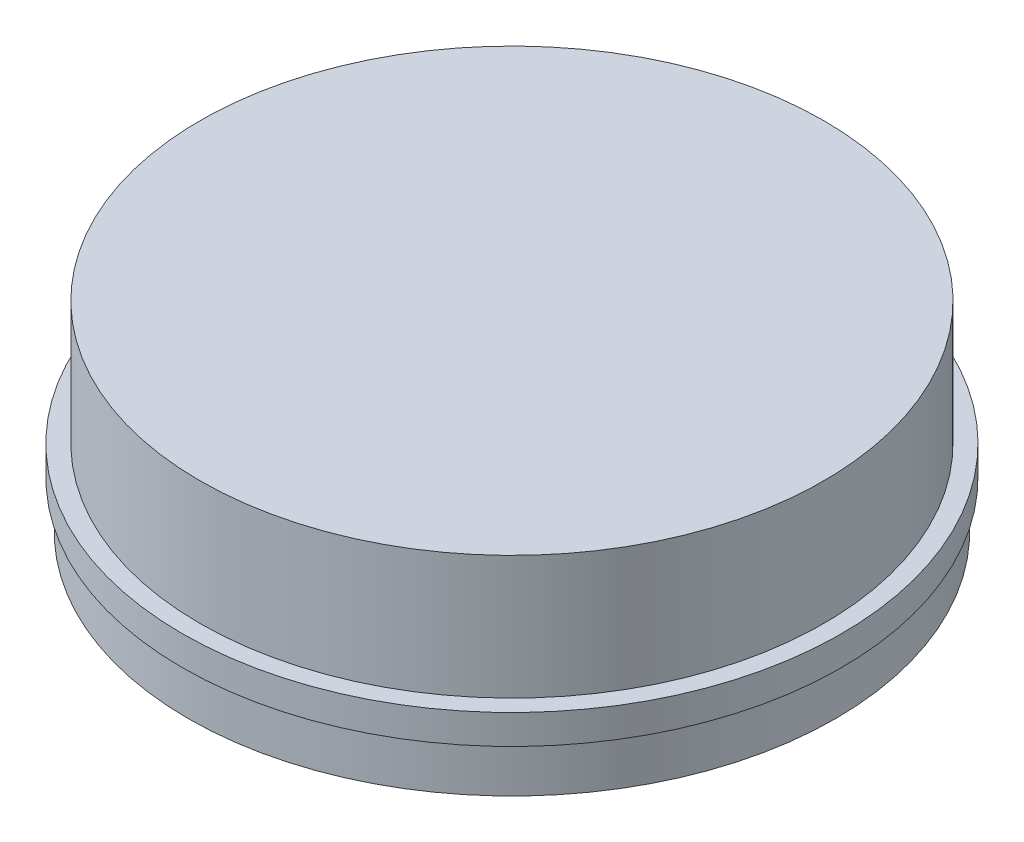
from build123d import *

# Parameters (mm, degrees)
SKETCH1_R           = 26.5
BOSS_EXTRUDE1_DEPTH = 10.5
SKETCH1_3_R         = 28
BOSS_EXTRUDE2_DEPTH = 2.5
BOSS_EXTRUDE3_START = -6.5
SKETCH1_4_R         = 27.5
SKETCH1_4_R_2       = 26.5
BOSS_EXTRUDE3_DEPTH = 6.5


with BuildPart() as part:
    # Sketch1 → Boss-Extrude1 (new body)
    with BuildSketch(Plane(origin=(0, 0, 0), x_dir=(1, 0, 0), z_dir=(0, 1, 0))):
        Circle(SKETCH1_R)
    extrude(amount=BOSS_EXTRUDE1_DEPTH)

    # Sketch1<3> → Boss-Extrude2 (add)
    with BuildSketch(Plane(origin=(0, 0, 0), x_dir=(1, 0, 0), z_dir=(0, 1, 0))):
        Circle(SKETCH1_3_R)
    extrude(amount=-BOSS_EXTRUDE2_DEPTH)

    # Sketch1<4> → Boss-Extrude3 (add)
    with BuildSketch(Plane(origin=(0, 0, 0), x_dir=(1, 0, 0), z_dir=(0, 1, 0)).offset(BOSS_EXTRUDE3_START)):
        Circle(SKETCH1_4_R)
        Circle(SKETCH1_4_R_2, mode=Mode.SUBTRACT)
    extrude(amount=BOSS_EXTRUDE3_DEPTH)


solid = part.part
